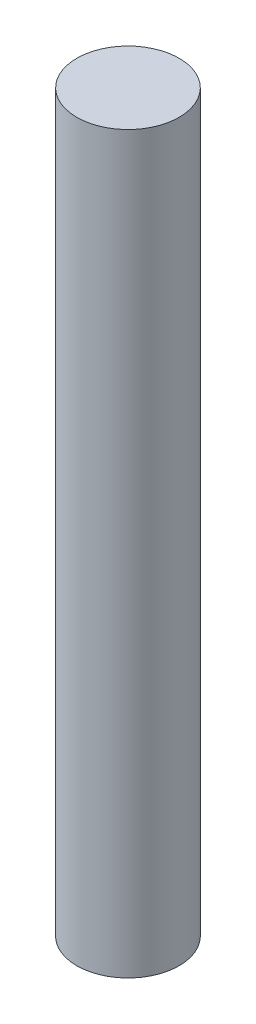
from build123d import *

# Parameters (mm, degrees)
SKETCH1_R           = 1.95
BOSS_EXTRUDE1_DEPTH = 28


with BuildPart() as part:
    # Sketch1 → Boss-Extrude1 (new body)
    with BuildSketch(Plane(origin=(0, 0, 0), x_dir=(1, 0, 0), z_dir=(0, 1, 0))):
        with Locations(Location((0, 0, 0), (0, 0, 270))):
            Circle(SKETCH1_R)
    extrude(amount=BOSS_EXTRUDE1_DEPTH)


solid = part.part
